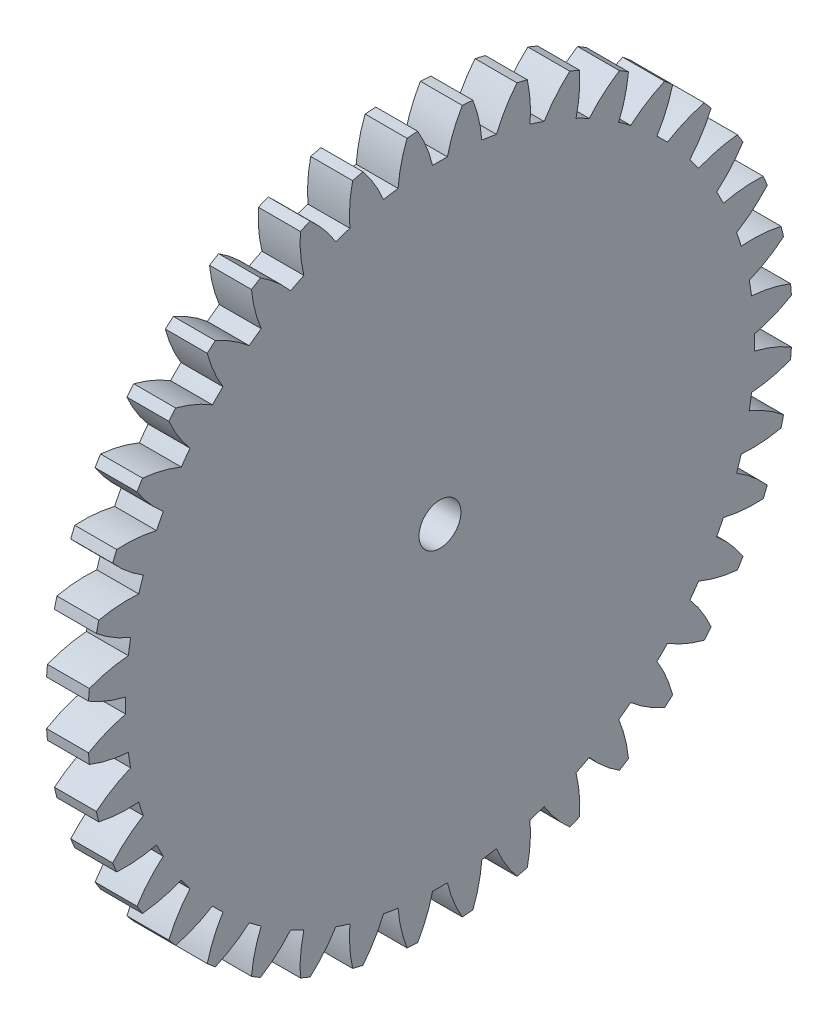
from build123d import *

# Parameters (mm, degrees)
BASPROSKE_W     = 5
BASPROSKE_H     = 42
TOOTHCUT_DEPTH  = 60.607046563
TEETHCUTS_COUNT = 40
TEETHCUTS_ANGLE = 351
BORSKE_R        = 2.5
BORE_DEPTH      = 50.0000508


with BuildPart() as part:
    # BasProSke → Base-Revolve (revolve)
    with BuildSketch(Plane(origin=(0, 0, 0), x_dir=(1, 0, 0), z_dir=(0, 1, 0)), mode=Mode.PRIVATE) as base_revolve_sk:
        with Locations((2.5, 21)):
            Rectangle(BASPROSKE_W, BASPROSKE_H)
    revolve(base_revolve_sk.sketch.rotate(Axis((-10, 0, 0), (1, 0, 0)), 180), axis=Axis((-10, 0, 0), (1, 0, 0)))

    # TooCutSke → ToothCut (cut, through all)
    with BuildSketch(Plane(origin=(0, 0, 0), x_dir=(0, 0, -1), z_dir=(1, 0, 0))):
        with BuildLine():
            ThreePointArc((0.882812088, 37.488606854), (0, 37.499), (-0.882812088, 37.488606854))
            ThreePointArc((-0.882812088, 37.488606854), (-1.612748684, 39.782000434), (-2.678427154, 41.939960338))
            ThreePointArc((-2.678427154, 41.939960338), (0, 42.0254), (2.678427154, 41.939960338))
            ThreePointArc((2.678427154, 41.939960338), (1.612748684, 39.782000434), (0.882812088, 37.488606854))
        make_face()
    toothcut = extrude(amount=TOOTHCUT_DEPTH, mode=Mode.SUBTRACT)

    # TeethCuts: ToothCut ×40 about axis
    teethcuts_axis = Axis((-10, 0, 0), (1, 0, 0))
    for i in range(1, TEETHCUTS_COUNT):
        add(toothcut.rotate(teethcuts_axis, i * TEETHCUTS_ANGLE / (TEETHCUTS_COUNT - 1)), mode=Mode.SUBTRACT)

    # BorSke → Bore (cut, symmetric)
    with BuildSketch(Plane(origin=(0, 0, 0), x_dir=(0, 0, -1), z_dir=(1, 0, 0))):
        with Locations(Location((0, 0, 0), (0, 0, 180))):
            Circle(BORSKE_R)
    extrude(amount=BORE_DEPTH, both=True, mode=Mode.SUBTRACT)


solid = part.part
